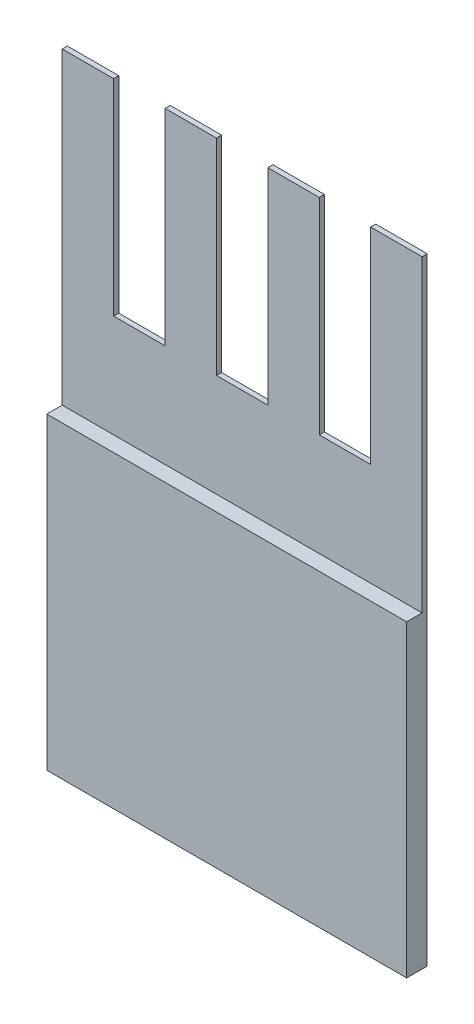
from build123d import *

# Parameters (mm, degrees)
SKETCH1_W           = 35
SKETCH1_H           = 30
BOSS_EXTRUDE5_DEPTH = 2
BOSS_EXTRUDE6_DEPTH = 0.5


with BuildPart() as part:
    # Sketch1 → Boss-Extrude5 (new body)
    with BuildSketch(Plane.XY):
        with Locations((0, -15)):
            Rectangle(SKETCH1_W, SKETCH1_H)
    extrude(amount=BOSS_EXTRUDE5_DEPTH)

    # Sketch1<7> → Boss-Extrude6 (add)
    with BuildSketch(Plane.XY):
        Polygon((-12.5, 10), (-12.5, 30), (-17.5, 30), (-17.5, 10), (-17.5, 0), (17.5, 0), (17.5, 10), (17.5, 30), (12.5, 30), (12.5, 10), (7.5, 10), (7.5, 30), (2.5, 30), (2.5, 10), (-2.5, 10), (-2.5, 30), (-7.5, 30), (-7.5, 10), align=None)
    extrude(amount=BOSS_EXTRUDE6_DEPTH)


solid = part.part
